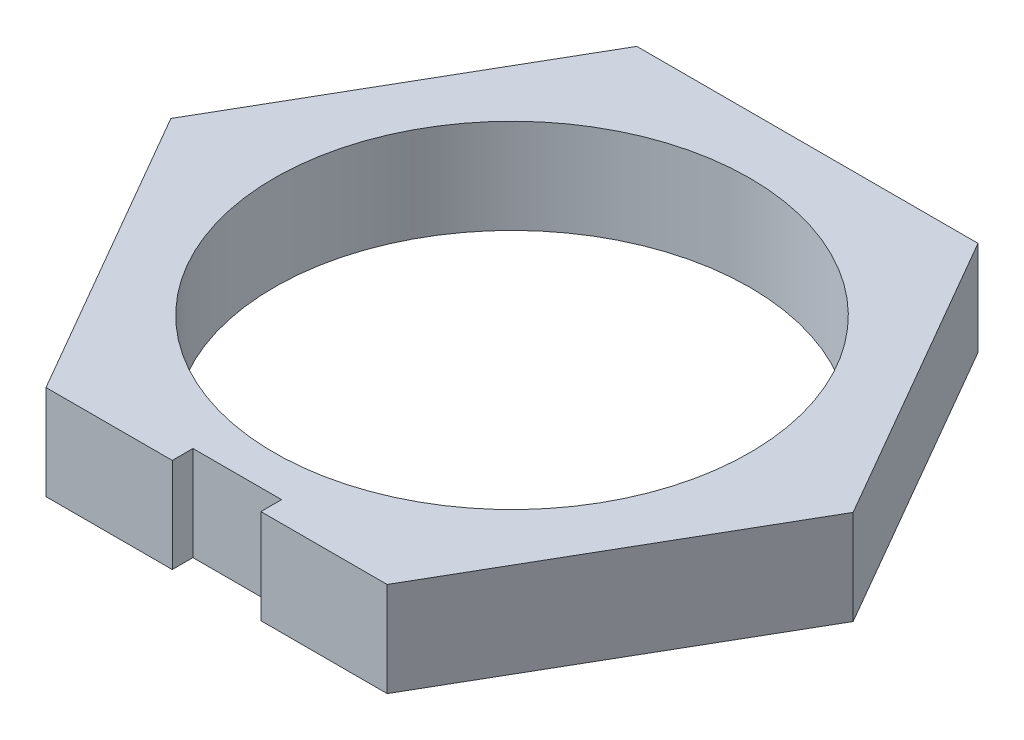
from build123d import *

# Parameters (mm, degrees)
SKETCH1_R           = 10.2235
BOSS_EXTRUDE1_DEPTH = 4.064


with BuildPart() as part:
    # Sketch1 → Boss-Extrude1 (new body)
    with BuildSketch(Plane(origin=(0, 2.032, 0), x_dir=(-1, 0, 0), z_dir=(0, 1, 0))):
        Polygon((1.905, 12.7), (1.905, 11.811), (-1.905, 11.811), (-1.905, 12.7), (-7.332348419, 12.7), (-14.664696837, 0), (-7.332348419, -12.7), (7.332348419, -12.7), (14.664696837, 0), (7.332348419, 12.7), align=None)
        with Locations(Location((0, 0, 0), (0, 0, 270))):
            Circle(SKETCH1_R, mode=Mode.SUBTRACT)
    extrude(amount=-BOSS_EXTRUDE1_DEPTH)


solid = part.part
